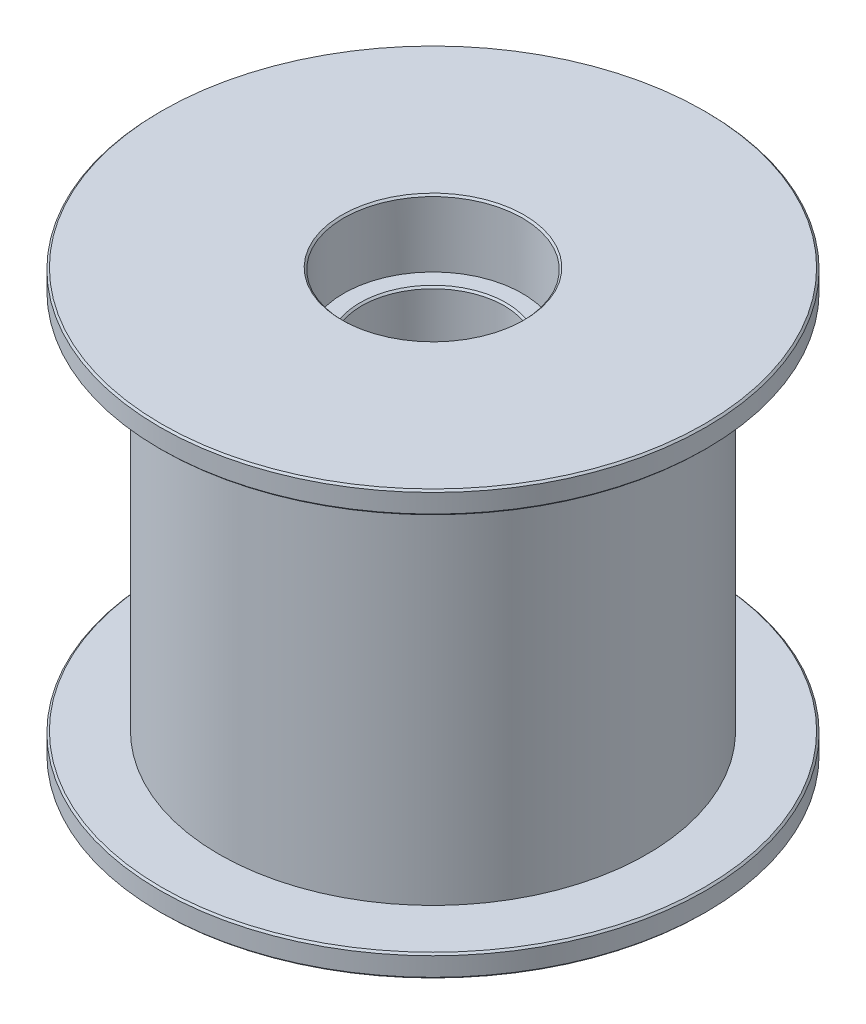
from build123d import *

# Parameters (mm, degrees)
CHAMFER1_SIZE = 0.127


with BuildPart() as part:
    # Sketch1 → Revolve1 (revolve)
    with BuildSketch(Plane.XY, mode=Mode.PRIVATE) as revolve1_sk:
        Polygon((6.3627, 0), (19.446875, 0), (19.446875, 1.5875), (15.24, 1.5875), (15.24, 28.575), (19.446875, 28.575), (19.446875, 30.1625), (6.3627, 30.1625), (6.3627, 25.3873), (5.08, 25.3873), (5.08, 4.7752), (6.3627, 4.7752), align=None)
    revolve(revolve1_sk.sketch.rotate(Axis((0, 30.1625, 0), (0, -1, 0)), 90), axis=Axis((0, 30.1625, 0), (0, -1, 0)))

    # Chamfer1
    chamfer1_edges = [part.edges().sort_by_distance(p)[0] for p in [
        (0, 4.7752, -5.08),
        (0, 25.3873, -5.08),
        (0, 30.1625, -6.3627),
        (0, 30.1625, -19.446875),
        (0, 28.575, -19.446875),
        (0, 1.5875, -19.446875),
        (0, 0, -19.446875),
        (0, 0, -6.3627),
    ]]
    chamfer(chamfer1_edges, length=CHAMFER1_SIZE)


solid = part.part
